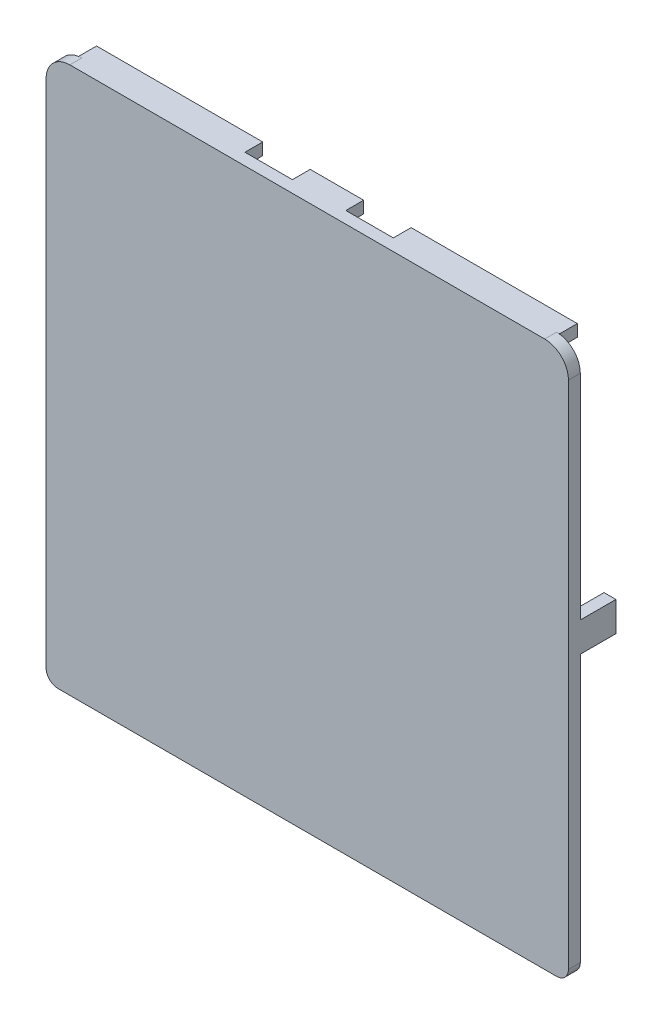
from build123d import *

# Parameters (mm, degrees)
SKETCH1_W           = 88
SKETCH1_H           = 92
BOSS_EXTRUDE1_DEPTH = 2
FILLET1_R           = 4
SKETCH3_W           = 28
SKETCH3_H           = 2
SKETCH3_W_2         = 9
BOSS_EXTRUDE3_DEPTH = 3
SKETCH4_W           = 2
SKETCH4_H           = 5
BOSS_EXTRUDE4_DEPTH = 6
FILLET2_R           = 2
BOSS_EXTRUDE5_DEPTH = 2
FILLET4_R           = 0.5


with BuildPart() as part:
    # Sketch1 → Boss-Extrude1 (new body)
    with BuildSketch(Plane.XY):
        with Locations((-29.854657196, 17.8829867)):
            Rectangle(SKETCH1_W, SKETCH1_H)
    extrude(amount=BOSS_EXTRUDE1_DEPTH)

    # Fillet1
    fillet1_edges = [part.edges().sort_by_distance(p)[0] for p in [
        (-73.854657196, 63.8829867, 1),
        (14.145342804, 63.8829867, 1),
    ]]
    fillet(fillet1_edges, radius=FILLET1_R)

    # Sketch3 → Boss-Extrude3 (add)
    with BuildSketch(Plane(origin=(0, 0, 0), x_dir=(-1, 0, 0), z_dir=(0, 0, -1))):
        with Locations((56.354657196, 62.8829867)):
            Rectangle(SKETCH3_W, SKETCH3_H)
        with Locations((29.854657196, 62.8829867)):
            Rectangle(SKETCH3_W_2, SKETCH3_H)
        with Locations((3.354657196, 62.8829867)):
            Rectangle(SKETCH3_W, SKETCH3_H)
    extrude(amount=BOSS_EXTRUDE3_DEPTH)

    # Sketch4 → Boss-Extrude4 (add)
    with BuildSketch(Plane(origin=(0, 0, 0), x_dir=(-1, 0, 0), z_dir=(0, 0, -1))):
        with Locations((-13.145342804, 21.3829867)):
            Rectangle(SKETCH4_W, SKETCH4_H)
    extrude(amount=BOSS_EXTRUDE4_DEPTH)

    # Fillet2
    fillet2_edges = [part.edges().sort_by_distance(p)[0] for p in [
        (14.145342804, -28.1170133, 1),
        (-73.854657196, -28.1170133, 1),
    ]]
    fillet(fillet2_edges, radius=FILLET2_R)

    # Sketch5 → Boss-Extrude5 (add)
    with BuildSketch(Plane(origin=(0, 0, 0), x_dir=(-1, 0, 0), z_dir=(0, 0, -1))):
        Polygon((71.854657196, -26.1170133), (68.854657196, -26.1170133), (-12.145342804, -26.1170133), (-12.145342804, -23.1170133), (-12.145342804, 54.889958553), (-9.145342804, 54.889958553), (-9.145342804, -23.1170133), (68.854657196, -23.1170133), (68.854657196, 54.749214955), (71.854657196, 54.749214955), align=None)
    extrude(amount=BOSS_EXTRUDE5_DEPTH)

    # Fillet4
    fillet4_edges = [part.edges().sort_by_distance(p)[0] for p in [
        (-71.854657196, 14.316100828, -2),
        (12.145342804, 39.386472626, -2),
        (12.145342804, -3.6170133, -2),
        (-29.854657196, -26.1170133, -2),
    ]]
    fillet(fillet4_edges, radius=FILLET4_R)


solid = part.part
